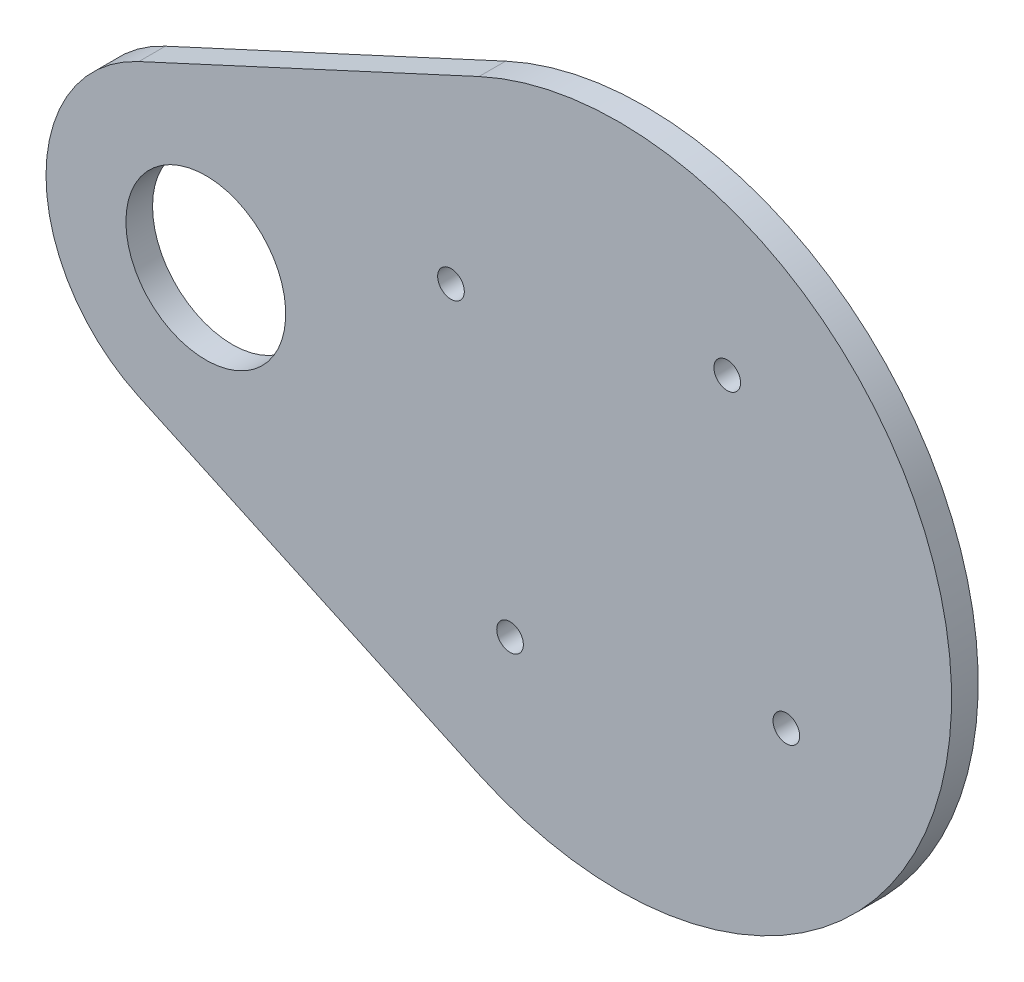
from build123d import *

# Parameters (mm, degrees)
SKETCH1_R           = 1
SKETCH1_R_2         = 7.5
BOSS_EXTRUDE1_DEPTH = 2


with BuildPart() as part:
    # Sketch1 → Boss-Extrude1 (new body)
    # profile 1 of 2: a face of its own
    with BuildSketch(Plane.XY):
        with BuildLine():
            ThreePointArc((-36.032258065, 10.893868862), (-43, 0), (-36.032258065, -10.893868862))
            Line((-36.032258065, -10.893868862), (-10.483870968, -22.695560128))
            ThreePointArc((-10.483870968, -22.695560128), (8.421796013, -23.538762752), (22.501635968, -10.893868862))
            ThreePointArc((22.501635968, -10.893868862), (25, 0), (22.501635968, 10.893868862))
            ThreePointArc((22.501635968, 10.893868862), (8.421796013, 23.538762752), (-10.483870968, 22.695560128))
            Line((-10.483870968, 22.695560128), (-36.032258065, 10.893868862))
        make_face()
        with Locations(Location((8.154330676, 12.589951995, 0), (0, 0, 180))):
            Circle(SKETCH1_R, mode=Mode.SUBTRACT)
        with Locations(Location((-8.154330676, -12.589951995, 0), (0, 0, 180))):
            Circle(SKETCH1_R, mode=Mode.SUBTRACT)
        with Locations((-31, 0)):
            Circle(SKETCH1_R_2, mode=Mode.SUBTRACT)
        with Locations(Location((12.589951995, -8.154330676, 0), (0, 0, 180))):
            Circle(SKETCH1_R, mode=Mode.SUBTRACT)
        with Locations(Location((-12.589951995, 8.154330676, 0), (0, 0, 180))):
            Circle(SKETCH1_R, mode=Mode.SUBTRACT)
    # profile 2 of 2: a face of its own
    with BuildSketch(Plane.XY):
        with Locations((-31, 0)):
            Circle(SKETCH1_R_2)
        with BuildLine():
            ThreePointArc((-36.597402681, 2.160806151), (-28.839193849, 5.597402681), (-25.402597319, -2.160806151))
            ThreePointArc((-25.402597319, -2.160806151), (-33.160806151, -5.597402681), (-36.597402681, 2.160806151))
        make_face(mode=Mode.SUBTRACT)
    extrude(amount=BOSS_EXTRUDE1_DEPTH)


solid = part.part
